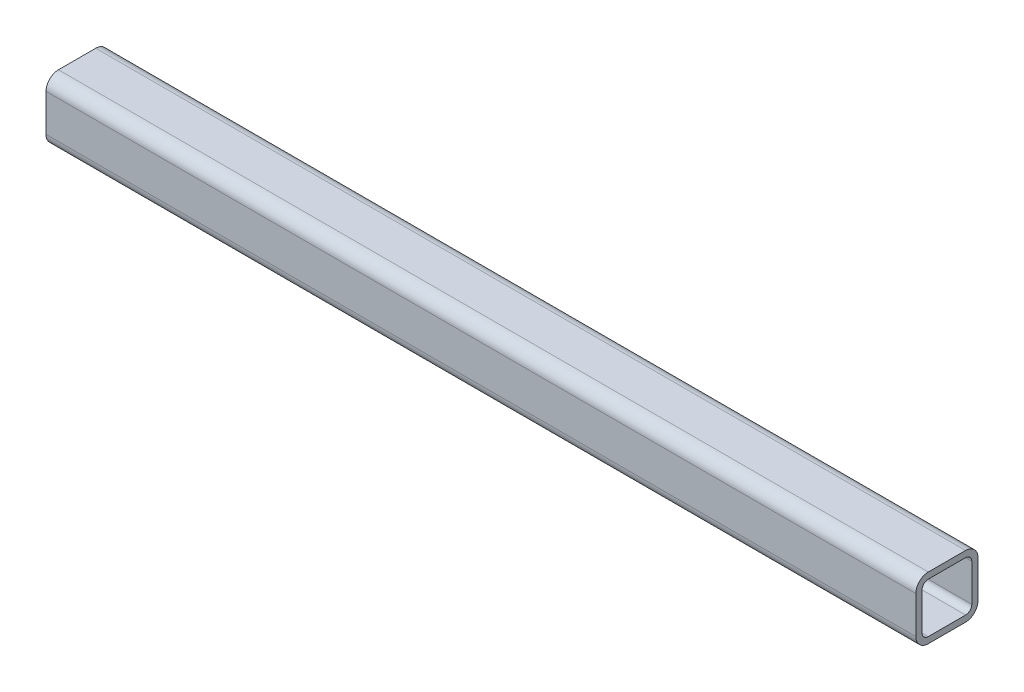
from build123d import *

# Parameters (mm, degrees)
TUBE_SQUARE_RHS50X50X5_1_DEPTH = 700


with BuildPart() as part:
    # Sketch1 → Tube (square) RHS50X50X5(1) (new body)
    with BuildSketch(Plane.YZ):
        with BuildLine():
            Line((-15, -25), (15, -25))
            ThreePointArc((15, -25), (22.071067812, -22.071067812), (25, -15))
            Line((25, -15), (25, 15))
            ThreePointArc((25, 15), (22.071067812, 22.071067812), (15, 25))
            Line((15, 25), (-15, 25))
            ThreePointArc((-15, 25), (-22.071067812, 22.071067812), (-25, 15))
            Line((-25, 15), (-25, -15))
            ThreePointArc((-25, -15), (-22.071067812, -22.071067812), (-15, -25))
        make_face()
        with BuildLine():
            Line((-15, -20), (15, -20))
            ThreePointArc((15, -20), (18.535533906, -18.535533906), (20, -15))
            Line((20, -15), (20, 15))
            ThreePointArc((20, 15), (18.535533906, 18.535533906), (15, 20))
            Line((15, 20), (-15, 20))
            ThreePointArc((-15, 20), (-18.535533906, 18.535533906), (-20, 15))
            Line((-20, 15), (-20, -15))
            ThreePointArc((-20, -15), (-18.535533906, -18.535533906), (-15, -20))
        make_face(mode=Mode.SUBTRACT)
    extrude(amount=TUBE_SQUARE_RHS50X50X5_1_DEPTH)


solid = part.part
